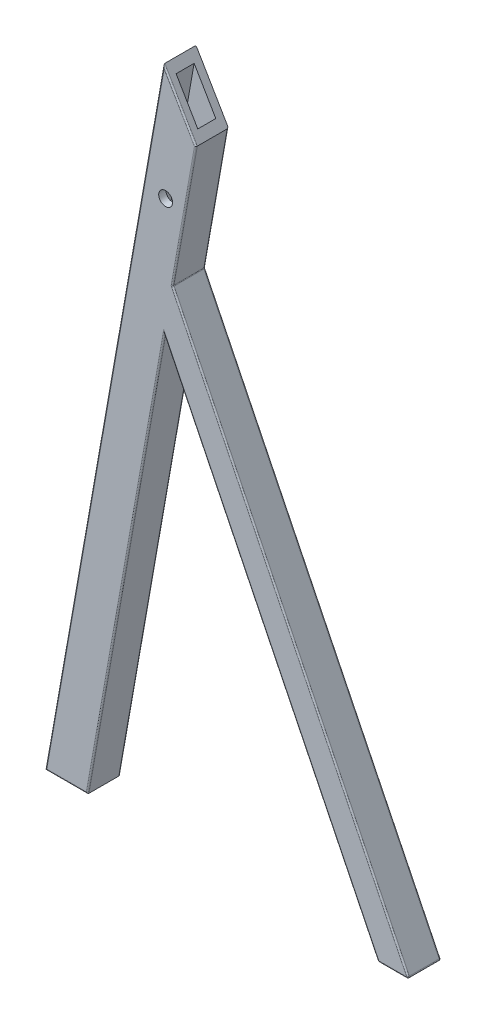
from build123d import *

# Parameters (mm, degrees)
BOSS_EXTRUDE2_DEPTH = 11.75
CUT_EXTRUDE1_DEPTH  = 6.5
SKETCH3_R           = 5
CUT_EXTRUDE2_DEPTH  = 540.96055804
FILLET2_R           = 1


with BuildPart() as part:
    # Sketch1 → Boss-Extrude2 (new, symmetric)
    with BuildSketch(Plane.XY):
        Polygon((-154.033564487, 314.282772375), (-148.14056714, 347.703621092), (22.272935761, 0), (0, 0), align=None)
        Polygon((-154.718136007, 483.163488855), (-239.912895185, 0), (-209.450096828, 0), (-131.308416878, 443.163488855), align=None)
    extrude(amount=BOSS_EXTRUDE2_DEPTH, both=True)

    # Sketch2 → Cut-Extrude1 (cut, symmetric)
    with BuildSketch(Plane.XY):
        Polygon((-234.483108164, 2), (-214.174575926, 2), (-126.011085572, 502), (-139.266538582, 542), align=None)
    extrude(amount=CUT_EXTRUDE1_DEPTH, both=True, mode=Mode.SUBTRACT)

    # Sketch3 → Cut-Extrude2 (cut, through all)
    with BuildSketch(Plane.XY.offset(11.75)):
        with Locations((-153.135277111, 400)):
            Circle(SKETCH3_R)
    extrude(amount=-CUT_EXTRUDE2_DEPTH, mode=Mode.SUBTRACT)

    # Fillet2
    fillet2_edges = [part.edges().sort_by_distance(p)[0] for p in [
        (-62.933815689, 173.851810546, -11.75),
        (11.136467881, 0, 11.75),
        (-77.016782243, 157.141386187, 11.75),
        (-181.741830658, 157.141386187, 11.75),
        (-224.681496007, 0, 11.75),
        (-197.315515596, 241.581744428, 11.75),
        (-143.013276442, 463.163488855, 11.75),
        (-139.724492009, 395.433554974, 11.75),
        (-62.933815689, 173.851810546, 11.75),
        (11.136467881, 0, -11.75),
        (-77.016782243, 157.141386187, -11.75),
        (0, 0, 0),
        (22.272935761, 0, 0),
        (-148.14056714, 347.703621092, 0),
        (-181.741830658, 157.141386187, -11.75),
        (-197.315515596, 241.581744428, -11.75),
        (-139.724492009, 395.433554974, -11.75),
    ]]
    fillet(fillet2_edges, radius=FILLET2_R)


solid = part.part
